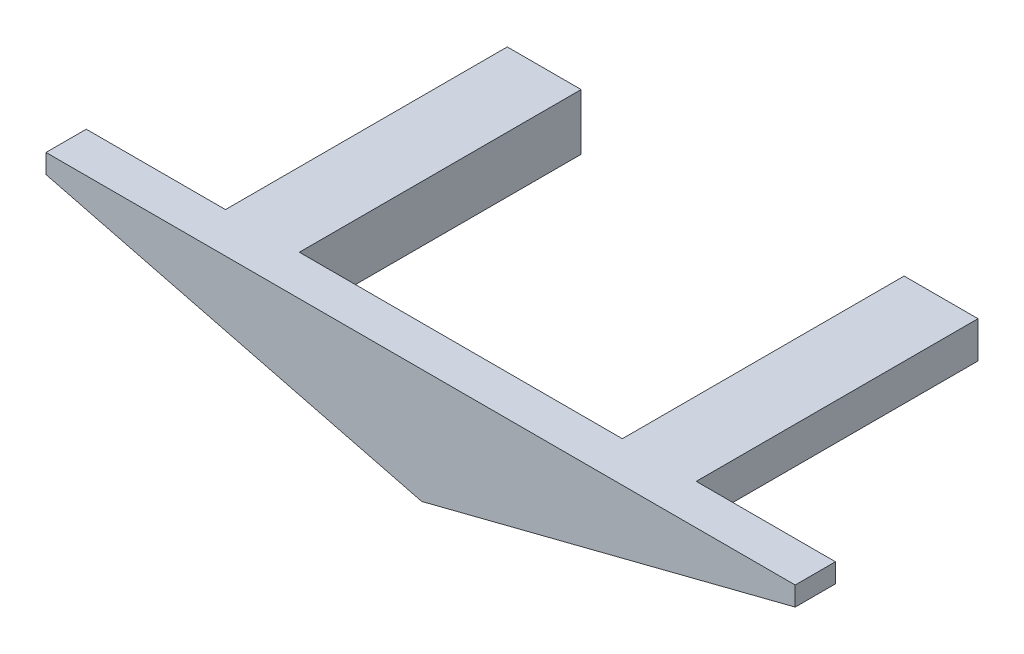
from build123d import *

# Parameters (mm, degrees)
BOSS_EXTRUDE1_DEPTH   = 40
BOSS_EXTRUDE1_2_DEPTH = 40
BOSS_EXTRUDE2_DEPTH   = 5


with BuildPart() as part:
    # Sketch2 → Boss-Extrude1 (new body)
    with BuildSketch(Plane.XY.offset(-35)):
        Polygon((-29.235736387, -93.619070837), (-29.235736387, -98.170199329), (-20.059825436, -100.584912737), (-20.059825436, -93.619070837), align=None)
    extrude(amount=BOSS_EXTRUDE1_DEPTH)



with BuildPart() as body_2:
    # Sketch2 → Boss-Extrude1 2 (new body)
    with BuildSketch(Plane.XY.offset(-35)):
        Polygon((29.235736387, -98.170199329), (20.059825436, -100.584912737), (20.059825436, -93.619070837), (29.235736387, -93.619070837), align=None)
    extrude(amount=BOSS_EXTRUDE1_2_DEPTH)


with BuildPart() as part_1:
    add(part.part)

    add(body_2.part)  # Boss-Extrude2 merges body 2
    # Sketch3 → Boss-Extrude2 (add)
    with BuildSketch(Plane.XY):
        Polygon((-46.530024654, -93.619070837), (0.133009642, -93.619070837), (46.530024654, -93.619070837), (46.530024654, -95.999382249), (0.133009642, -107.832641703), (-46.530024654, -95.999382249), align=None)
    extrude(amount=BOSS_EXTRUDE2_DEPTH)


solid = part_1.part
